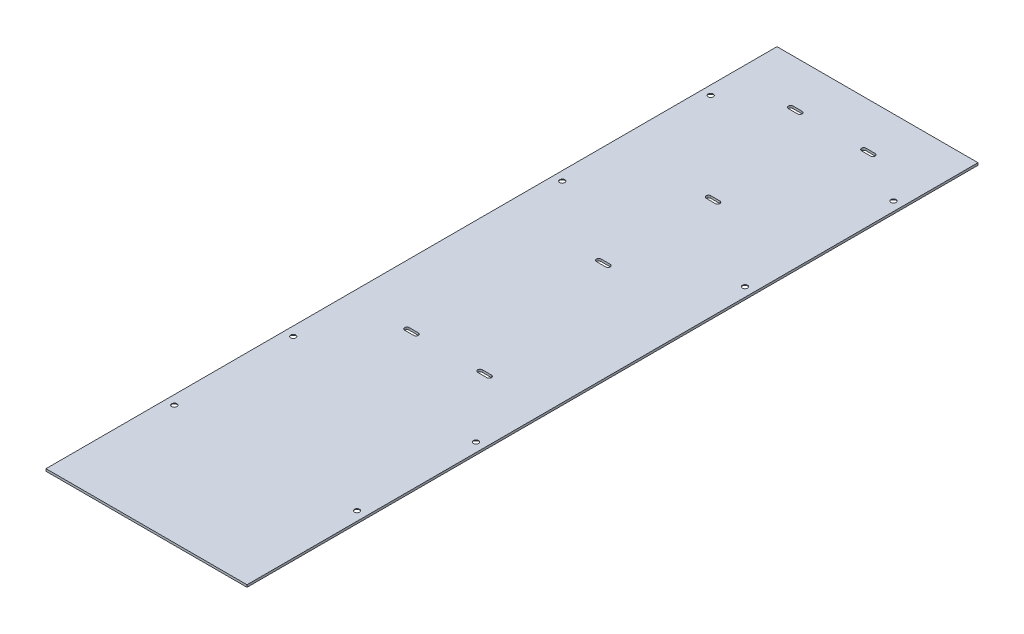
from build123d import *

# Parameters (mm, degrees)
SKETCH1_W                                   = 279.4
SKETCH1_H                                   = 1016
BOSS_EXTRUDE1_DEPTH                         = 3.175
CSK_FOR_1_4_FLAT_HEAD_MACHINE_SCREW_2_COUNT = 2
CSK_FOR_1_4_FLAT_HEAD_MACHINE_SCREW_2_PITCH = 254
CSK_FOR_1_4_FLAT_HEAD_MACHINE_SCREW_3_COUNT = 2
CSK_FOR_1_4_FLAT_HEAD_MACHINE_SCREW_3_PITCH = 303.105703305
CSK_FOR_1_4_FLAT_HEAD_MACHINE_SCREW_4_COUNT = 2
CSK_FOR_1_4_FLAT_HEAD_MACHINE_SCREW_4_PITCH = 165.39972
CSK_FOR_1_4_FLAT_HEAD_MACHINE_SCREW_5_COUNT = 2
CSK_FOR_1_4_FLAT_HEAD_MACHINE_SCREW_5_PITCH = 539.26232
CSK_FOR_1_4_FLAT_HEAD_MACHINE_SCREW_6_COUNT = 2
CSK_FOR_1_4_FLAT_HEAD_MACHINE_SCREW_6_PITCH = 596.087115925
CSK_FOR_1_4_FLAT_HEAD_MACHINE_SCREW_7_COUNT = 2
CSK_FOR_1_4_FLAT_HEAD_MACHINE_SCREW_7_PITCH = 787.664432868
CSK_FOR_1_4_FLAT_HEAD_MACHINE_SCREW_8_COUNT = 2
CSK_FOR_1_4_FLAT_HEAD_MACHINE_SCREW_8_PITCH = 745.58652


with BuildPart() as part:
    # Sketch1 → Boss-Extrude1 (new body)
    with BuildSketch(Plane(origin=(0, 0, 0), x_dir=(1, 0, 0), z_dir=(0, 1, 0))):
        Rectangle(SKETCH1_W, SKETCH1_H)
        with BuildLine():
            Line((44.45, -85.725), (57.15, -85.725))
            ThreePointArc((57.15, -85.725), (60.325, -88.9), (57.15, -92.075))
            Line((57.15, -92.075), (44.45, -92.075))
            ThreePointArc((44.45, -92.075), (41.275, -88.9), (44.45, -85.725))
        make_face(mode=Mode.SUBTRACT)
        with BuildLine():
            Line((-44.45, -85.725), (-57.15, -85.725))
            ThreePointArc((-57.15, -85.725), (-60.325, -88.9), (-57.15, -92.075))
            Line((-57.15, -92.075), (-44.45, -92.075))
            ThreePointArc((-44.45, -92.075), (-41.275, -88.9), (-44.45, -85.725))
        make_face(mode=Mode.SUBTRACT)
        with BuildLine():
            Line((57.15, 441.325), (44.45, 441.325))
            ThreePointArc((44.45, 441.325), (41.275, 444.5), (44.45, 447.675))
            Line((44.45, 447.675), (57.15, 447.675))
            ThreePointArc((57.15, 447.675), (60.325, 444.5), (57.15, 441.325))
        make_face(mode=Mode.SUBTRACT)
        with BuildLine():
            Line((-57.15, 441.325), (-44.45, 441.325))
            ThreePointArc((-44.45, 441.325), (-41.275, 444.5), (-44.45, 447.675))
            Line((-44.45, 447.675), (-57.15, 447.675))
            ThreePointArc((-57.15, 447.675), (-60.325, 444.5), (-57.15, 441.325))
        make_face(mode=Mode.SUBTRACT)
        with BuildLine():
            Line((6.35, 276.225), (-6.35, 276.225))
            ThreePointArc((-6.35, 276.225), (-9.525, 279.4), (-6.35, 282.575))
            Line((-6.35, 282.575), (6.35, 282.575))
            ThreePointArc((6.35, 282.575), (9.525, 279.4), (6.35, 276.225))
        make_face(mode=Mode.SUBTRACT)
        with BuildLine():
            Line((-6.35, 130.175), (6.35, 130.175))
            ThreePointArc((6.35, 130.175), (9.525, 127), (6.35, 123.825))
            Line((6.35, 123.825), (-6.35, 123.825))
            ThreePointArc((-6.35, 123.825), (-9.525, 127), (-6.35, 130.175))
        make_face(mode=Mode.SUBTRACT)
    extrude(amount=BOSS_EXTRUDE1_DEPTH)

    # Sketch5 → CSK for 1/4 Flat Head Machine Screw (100)1 (revolve, cut)
    with BuildSketch(Plane(origin=(-127, 0, 342.41232), x_dir=(0, 0, -1), z_dir=(1, 0, 0))):
        Polygon((0, 0), (0, 3.175), (3.57124, 3.175), (3.57124, 2.406252448), (6.4389, 0), align=None)
    csk_for_1_4_flat_head_machine_screw_100 = revolve(axis=Axis((-127, -6.35, 342.41232), (0, 1, 0)), mode=Mode.SUBTRACT)

    # CSK for 1_4 Flat Head Machine Screw  2: CSK for 1/4 Flat Head Machine Screw (100)1 ×2
    with Locations(*[(i * CSK_FOR_1_4_FLAT_HEAD_MACHINE_SCREW_2_PITCH, 0, 0) for i in range(1, CSK_FOR_1_4_FLAT_HEAD_MACHINE_SCREW_2_COUNT)]):
        add(csk_for_1_4_flat_head_machine_screw_100, mode=Mode.SUBTRACT)

    # CSK for 1_4 Flat Head Machine Screw  3: CSK for 1/4 Flat Head Machine Screw (100)1 ×2
    with Locations(*[Vector(0.8379914901974974, 0, -0.5456832985868064) * (i * CSK_FOR_1_4_FLAT_HEAD_MACHINE_SCREW_3_PITCH) for i in range(1, CSK_FOR_1_4_FLAT_HEAD_MACHINE_SCREW_3_COUNT)]):
        add(csk_for_1_4_flat_head_machine_screw_100, mode=Mode.SUBTRACT)

    # CSK for 1_4 Flat Head Machine Screw  4: CSK for 1/4 Flat Head Machine Screw (100)1 ×2
    with Locations(*[(0, 0, -i * CSK_FOR_1_4_FLAT_HEAD_MACHINE_SCREW_4_PITCH) for i in range(1, CSK_FOR_1_4_FLAT_HEAD_MACHINE_SCREW_4_COUNT)]):
        add(csk_for_1_4_flat_head_machine_screw_100, mode=Mode.SUBTRACT)

    # CSK for 1_4 Flat Head Machine Screw  5: CSK for 1/4 Flat Head Machine Screw (100)1 ×2
    with Locations(*[(0, 0, -i * CSK_FOR_1_4_FLAT_HEAD_MACHINE_SCREW_5_PITCH) for i in range(1, CSK_FOR_1_4_FLAT_HEAD_MACHINE_SCREW_5_COUNT)]):
        add(csk_for_1_4_flat_head_machine_screw_100, mode=Mode.SUBTRACT)

    # CSK for 1_4 Flat Head Machine Screw  6: CSK for 1/4 Flat Head Machine Screw (100)1 ×2
    with Locations(*[Vector(0.4261122128195085, 0, -0.9046703167928425) * (i * CSK_FOR_1_4_FLAT_HEAD_MACHINE_SCREW_6_PITCH) for i in range(1, CSK_FOR_1_4_FLAT_HEAD_MACHINE_SCREW_6_COUNT)]):
        add(csk_for_1_4_flat_head_machine_screw_100, mode=Mode.SUBTRACT)

    # CSK for 1_4 Flat Head Machine Screw  7: CSK for 1/4 Flat Head Machine Screw (100)1 ×2
    with Locations(*[Vector(0.3224723491386537, 0, -0.9465788842146218) * (i * CSK_FOR_1_4_FLAT_HEAD_MACHINE_SCREW_7_PITCH) for i in range(1, CSK_FOR_1_4_FLAT_HEAD_MACHINE_SCREW_7_COUNT)]):
        add(csk_for_1_4_flat_head_machine_screw_100, mode=Mode.SUBTRACT)

    # CSK for 1_4 Flat Head Machine Screw  8: CSK for 1/4 Flat Head Machine Screw (100)1 ×2
    with Locations(*[(0, 0, -i * CSK_FOR_1_4_FLAT_HEAD_MACHINE_SCREW_8_PITCH) for i in range(1, CSK_FOR_1_4_FLAT_HEAD_MACHINE_SCREW_8_COUNT)]):
        add(csk_for_1_4_flat_head_machine_screw_100, mode=Mode.SUBTRACT)


solid = part.part
